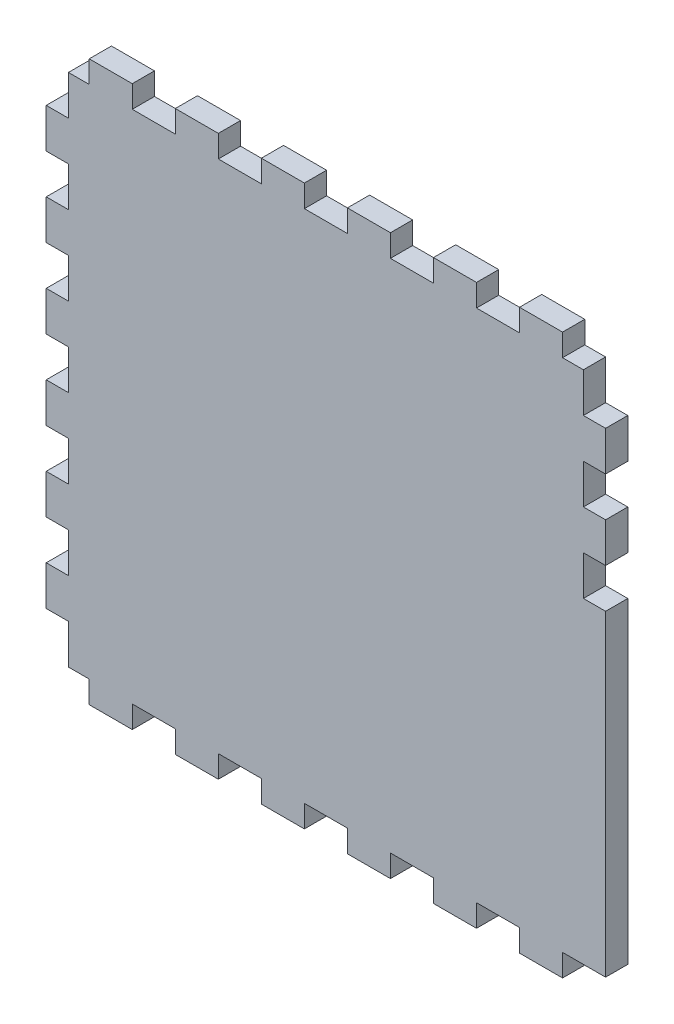
from build123d import *

# Parameters (mm, degrees)
SKETCH1_W           = 80
SKETCH1_H           = 80
BOSS_EXTRUDE1_DEPTH = 1.5875
SKETCH3_OUTSIDE_W   = 104.636
SKETCH3_OUTSIDE_H   = 104.636
CUT_EXTRUDE2_DEPTH  = 57.657573413
SKETCH4_W           = 3.175
SKETCH4_H           = 45.323076923
BOSS_EXTRUDE2_DEPTH = 3.175


with BuildPart() as part:
    # Sketch1 → Boss-Extrude1 (new, symmetric)
    with BuildSketch(Plane.XY):
        Rectangle(SKETCH1_W, SKETCH1_H)
    extrude(amount=BOSS_EXTRUDE1_DEPTH, both=True)

    # Sketch3 outside → Cut-Extrude2 (cut, through all)
    with BuildSketch(Plane.XY.offset(1.5875)):
        Rectangle(SKETCH3_OUTSIDE_W, SKETCH3_OUTSIDE_H)
        Polygon((-36.825, 36.825), (-33.846153846, 36.825), (-33.846153846, 40), (-27.692307692, 40), (-27.692307692, 36.825), (-21.538461538, 36.825), (-21.538461538, 40), (-15.384615385, 40), (-15.384615385, 36.825), (-9.230769231, 36.825), (-9.230769231, 40), (-3.076923077, 40), (-3.076923077, 36.825), (3.076923077, 36.825), (3.076923077, 40), (9.230769231, 40), (9.230769231, 36.825), (15.384615385, 36.825), (15.384615385, 40), (21.538461538, 40), (21.538461538, 36.825), (27.692307692, 36.825), (27.692307692, 40), (33.846153846, 40), (33.846153846, 36.825), (36.825, 36.825), (36.825, 31.159615385), (40, 31.159615385), (40, 25.494230769), (36.825, 25.494230769), (36.825, 19.828846154), (40, 19.828846154), (40, 14.163461538), (36.825, 14.163461538), (36.825, 8.498076923), (40, 8.498076923), (40, 2.832692308), (36.825, 2.832692308), (36.825, -2.832692308), (40, -2.832692308), (40, -8.498076923), (36.825, -8.498076923), (36.825, -14.163461538), (40, -14.163461538), (40, -19.828846154), (36.825, -19.828846154), (36.825, -25.494230769), (40, -25.494230769), (40, -31.159615385), (36.825, -31.159615385), (36.825, -36.825), (33.846153846, -36.825), (33.846153846, -40), (27.692307692, -40), (27.692307692, -36.825), (21.538461538, -36.825), (21.538461538, -40), (15.384615385, -40), (15.384615385, -36.825), (9.230769231, -36.825), (9.230769231, -40), (3.076923077, -40), (3.076923077, -36.825), (-3.076923077, -36.825), (-3.076923077, -40), (-9.230769231, -40), (-9.230769231, -36.825), (-15.384615385, -36.825), (-15.384615385, -40), (-21.538461538, -40), (-21.538461538, -36.825), (-27.692307692, -36.825), (-27.692307692, -40), (-33.846153846, -40), (-33.846153846, -36.825), (-36.825, -36.825), (-36.825, -31.159615385), (-40, -31.159615385), (-40, -25.494230769), (-36.825, -25.494230769), (-36.825, -19.828846154), (-40, -19.828846154), (-40, -14.163461538), (-36.825, -14.163461538), (-36.825, -8.498076923), (-40, -8.498076923), (-40, -2.832692308), (-36.825, -2.832692308), (-36.825, 2.832692308), (-40, 2.832692308), (-40, 8.498076923), (-36.825, 8.498076923), (-36.825, 14.163461538), (-40, 14.163461538), (-40, 19.828846154), (-36.825, 19.828846154), (-36.825, 25.494230769), (-40, 25.494230769), (-40, 31.159615385), (-36.825, 31.159615385), align=None, mode=Mode.SUBTRACT)
    extrude(amount=-CUT_EXTRUDE2_DEPTH, mode=Mode.SUBTRACT)

    # Sketch4 → Boss-Extrude2 (add)
    with BuildSketch(Plane.XY.offset(1.5875)):
        with Locations((38.4125, -14.163461539)):
            Rectangle(SKETCH4_W, SKETCH4_H)
    extrude(amount=-BOSS_EXTRUDE2_DEPTH)


solid = part.part
